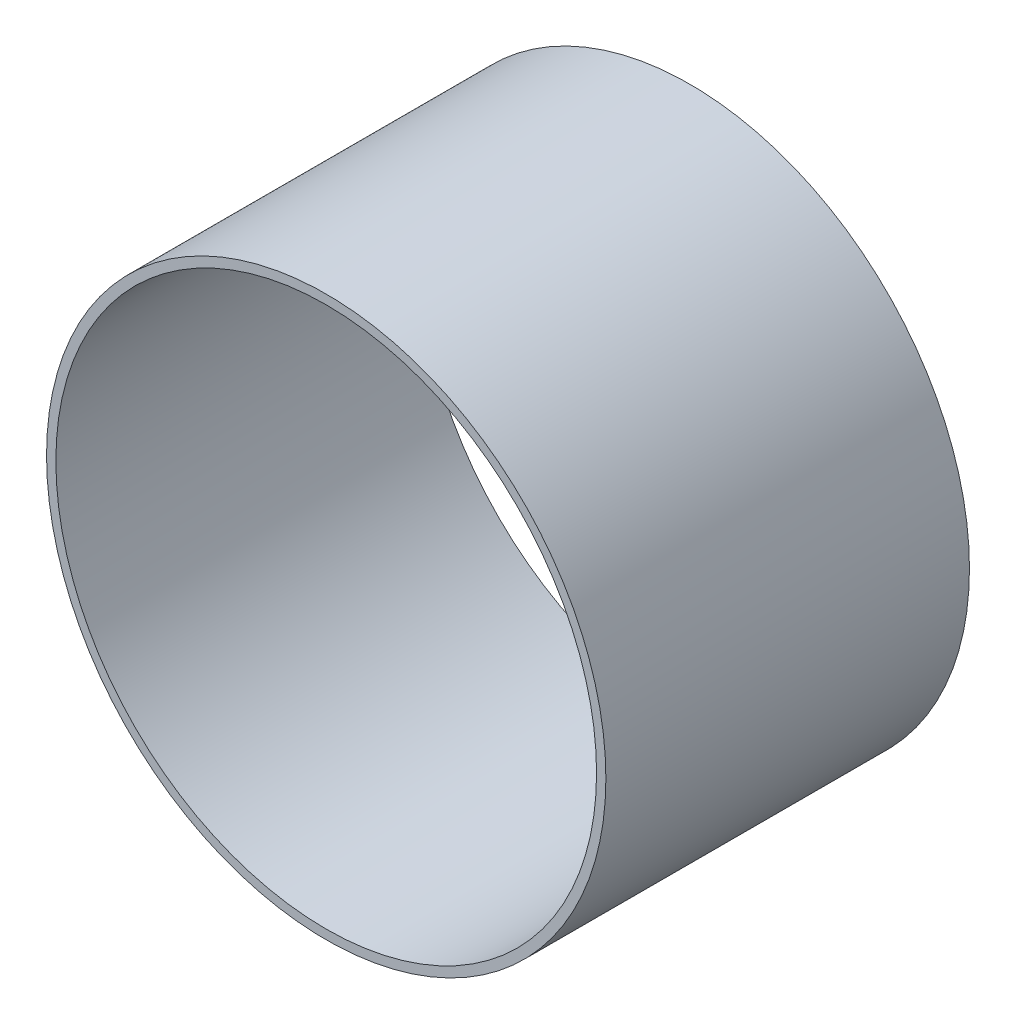
from build123d import *

# Parameters (mm, degrees)
SKETCH_2_R      = 90
SKETCH_2_R_2    = 87
EXTRUDE_1_DEPTH = 117


with BuildPart() as part:
    # 草图2 → 凸台-拉伸1 (new body)
    with BuildSketch(Plane.XY):
        Circle(SKETCH_2_R)
        Circle(SKETCH_2_R_2, mode=Mode.SUBTRACT)
    extrude(amount=EXTRUDE_1_DEPTH)


solid = part.part
